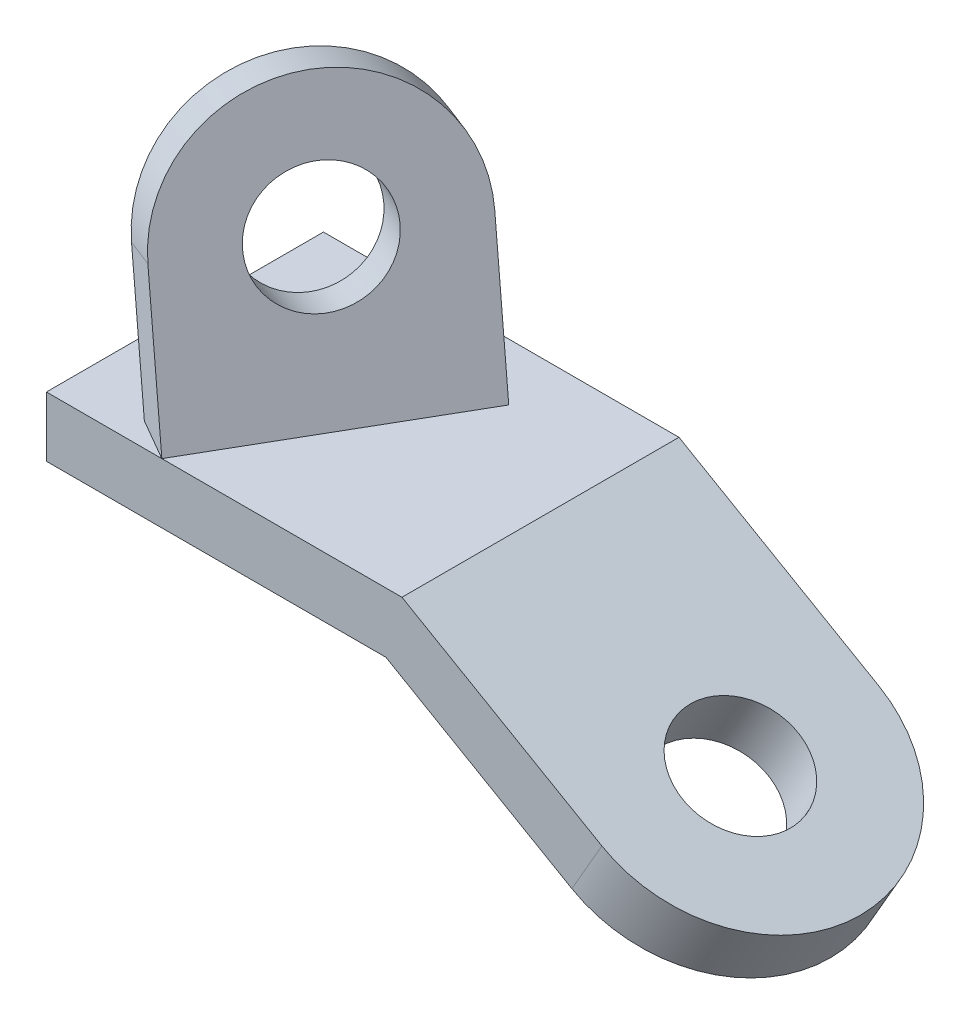
from build123d import *

# Parameters (mm, degrees)
BOSS_EXTRUDE1_DEPTH = 30
CUT_EXTRUDE1_REACH  = 151.186
SKETCH2_R           = 12.5
SKETCH4_R           = 12.5
BOSS_EXTRUDE2_DEPTH = 10


with BuildPart() as part:
    # Sketch1 → Boss-Extrude1 (new, symmetric)
    with BuildSketch(Plane.XY):
        Polygon((0, 0), (73.516660498, 0), (139.782032303, -38.258330249), (146.282032303, -27), (77, 13), (0, 13), align=None)
    extrude(amount=BOSS_EXTRUDE1_DEPTH, both=True)

    # Sketch2 → Cut-Extrude1 (cut, up to next)
    with BuildSketch(Plane(origin=(24.879165125, 43.091978046, 0), x_dir=(0.866025403784438, -0.5000000000000012, 0), z_dir=(0.5000000000000011, 0.8660254037844379, 0)), mode=Mode.PRIVATE) as cut_extrude1_sk1:
        with Locations(Location((110.183956091, 0, 0), (0, 0, 180))):
            Circle(SKETCH2_R)
    cut_extrude1_tool1 = extrude(cut_extrude1_sk1.sketch, amount=-CUT_EXTRUDE1_REACH, mode=Mode.PRIVATE) & part.part
    # Sketch2 → Cut-Extrude1 (cut, up to next)
    with BuildSketch(Plane(origin=(24.879165125, 43.091978046, 0), x_dir=(0.866025403784438, -0.5000000000000012, 0), z_dir=(0.5000000000000011, 0.8660254037844379, 0)), mode=Mode.PRIVATE) as cut_extrude1_sk2:
        with BuildLine():
            ThreePointArc((110.183956091, 30), (131.397159527, 21.213203436), (140.183956091, 0))
            Line((140.183956091, 0), (140.183956091, 30))
            Line((140.183956091, 30), (110.183956091, 30))
        make_face()
    cut_extrude1_tool2 = extrude(cut_extrude1_sk2.sketch, amount=-CUT_EXTRUDE1_REACH, mode=Mode.PRIVATE) & part.part
    # Sketch2 → Cut-Extrude1 (cut, up to next)
    with BuildSketch(Plane(origin=(24.879165125, 43.091978046, 0), x_dir=(0.866025403784438, -0.5000000000000012, 0), z_dir=(0.5000000000000011, 0.8660254037844379, 0)), mode=Mode.PRIVATE) as cut_extrude1_sk3:
        with BuildLine():
            Line((140.183956091, -30), (140.183956091, 0))
            ThreePointArc((140.183956091, 0), (131.397159527, -21.213203436), (110.183956091, -30))
            Line((110.183956091, -30), (140.183956091, -30))
        make_face()
    cut_extrude1_tool3 = extrude(cut_extrude1_sk3.sketch, amount=-CUT_EXTRUDE1_REACH, mode=Mode.PRIVATE) & part.part
    add(cut_extrude1_tool1.solids().sort_by_distance((120.30127, -12, 0))[0], mode=Mode.SUBTRACT)
    add(cut_extrude1_tool2.solids().sort_by_distance((140.478763, -23.649481, -23.298962))[0], mode=Mode.SUBTRACT)
    add(cut_extrude1_tool3.solids().sort_by_distance((140.478763, -23.649481, 23.298962))[0], mode=Mode.SUBTRACT)

    # Sketch4 → Boss-Extrude2 (add)
    with BuildSketch(Plane(origin=(32.428761251, 10.033493649, 18.722754038), x_dir=(0.500000000000004, 0, -0.8660254037844364), z_dir=(0.8365163037378064, 0.25881904510251796, 0.48296291314453843))):
        with BuildLine():
            Line((41.519237886, 35.071153364), (41.519237886, 3.071153364))
            Line((41.519237886, 3.071153364), (-13.480762114, 3.071153364))
            Line((-13.480762114, 3.071153364), (-13.480762114, 35.071153364))
            ThreePointArc((-13.480762114, 35.071153364), (14.019237886, 62.571153364), (41.519237886, 35.071153364))
        make_face()
        with Locations((14.019237886, 35.071153364)):
            Circle(SKETCH4_R, mode=Mode.SUBTRACT)
    extrude(amount=-BOSS_EXTRUDE2_DEPTH)


solid = part.part
